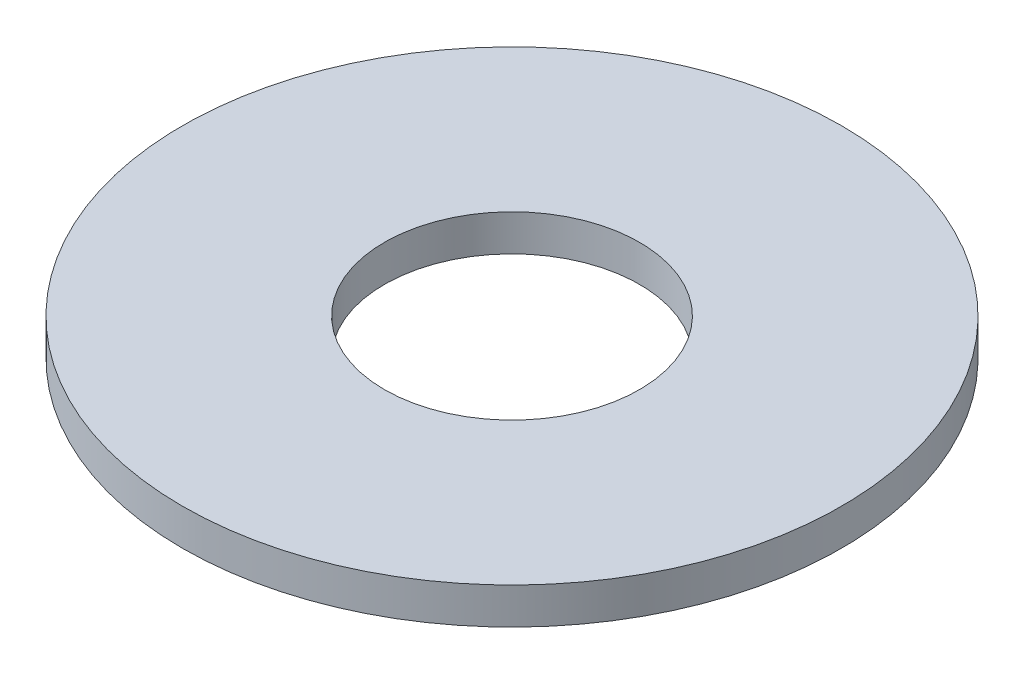
from build123d import *

# Parameters (mm, degrees)
SKETCH1_R           = 14.351
BOSS_EXTRUDE1_DEPTH = 1.5875
SKETCH2_R           = 5.55625
CUT_EXTRUDE1_DEPTH  = 21.357371104


with BuildPart() as part:
    # Sketch1 → Boss-Extrude1 (new body)
    with BuildSketch(Plane(origin=(0, 0, 0), x_dir=(1, 0, 0), z_dir=(0, 1, 0))):
        with Locations(Location((0, 0, 0), (0, 0, 270))):
            Circle(SKETCH1_R)
    extrude(amount=BOSS_EXTRUDE1_DEPTH)

    # Sketch2 → Cut-Extrude1 (cut, through all)
    with BuildSketch(Plane(origin=(0, 1.5875, 0), x_dir=(1, 0, 0), z_dir=(0, 1, 0))):
        with Locations(Location((0, 0, 0), (0, 0, 270))):
            Circle(SKETCH2_R)
    extrude(amount=-CUT_EXTRUDE1_DEPTH, mode=Mode.SUBTRACT)


solid = part.part
